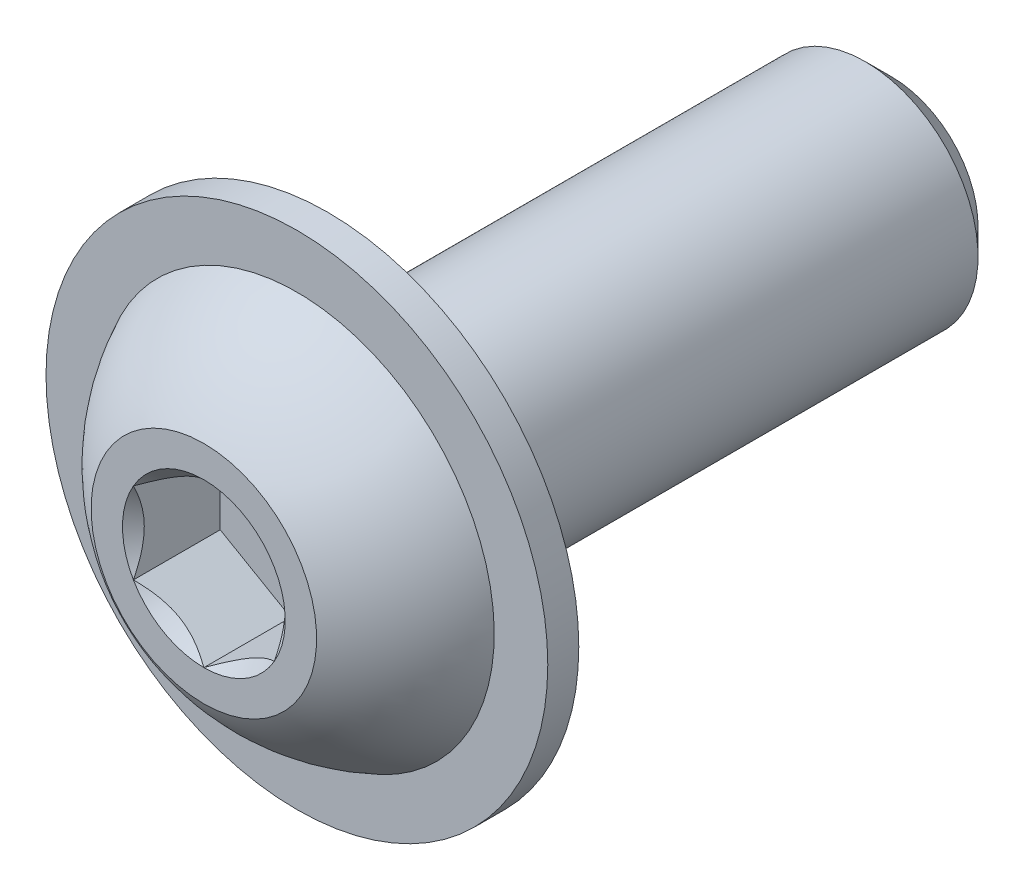
from build123d import *

# Parameters (mm, degrees)
SKETCH1_W           = 20
SKETCH1_H           = 4
CHAMFER1_SIZE       = 0.9375
SKETCH11_R          = 8.9
BOSS_EXTRUDE3_DEPTH = 1.1
CUT_EXTRUDE2_DEPTH  = 3.08


with BuildPart() as part:
    # Sketch1 → Revolve1 (revolve)
    with BuildSketch(Plane(origin=(0, 0, 0), x_dir=(0, 0, -1), z_dir=(1, 0, 0))):
        with Locations((14.4, 2)):
            Rectangle(SKETCH1_W, SKETCH1_H)
    revolve(axis=Axis((0, 0, -24.4), (0, 0, 1)))

    # Chamfer1
    chamfer1_edges = [part.edges().sort_by_distance(p)[0] for p in [
        (0, -4, -24.4),
    ]]
    chamfer(chamfer1_edges, length=CHAMFER1_SIZE)

    # Sketch7 → Revolve2 (revolve)
    with BuildSketch(Plane(origin=(0, 0, 0), x_dir=(0, 0, -1), z_dir=(1, 0, 0)), mode=Mode.PRIVATE) as revolve2_sk:
        with BuildLine():
            Line((3.3, 7), (4.4, 7))
            Line((4.4, 7), (4.4, 0))
            Line((4.4, 0), (0, 0))
            Line((0, 0), (0, 4))
            ThreePointArc((0, 4), (1.429846746, 5.74216858), (3.3, 7))
        make_face()
    revolve(revolve2_sk.sketch.rotate(Axis((0, 0, 0), (0, 0, -1)), 180), axis=Axis((0, 0, 0), (0, 0, -1)))

    # Sketch11 → Boss-Extrude3 (add)
    with BuildSketch(Plane(origin=(0, 0, -4.4), x_dir=(-1, 0, 0), z_dir=(0, 0, -1))):
        Circle(SKETCH11_R)
    extrude(amount=-BOSS_EXTRUDE3_DEPTH)

    # Sketch5 → Cut-Extrude2 (cut)
    with BuildSketch(Plane.XY):
        Polygon((2.5, -1.443375673), (2.5, 1.443375673), (0, 2.886751346), (-2.5, 1.443375673), (-2.5, -1.443375673), (0, -2.886751346), align=None)
    extrude(amount=-CUT_EXTRUDE2_DEPTH, mode=Mode.SUBTRACT)

    # Cut-Extrude3 cone 1 section (through the dimple's axis) → Cut-Extrude3 (revolve, cut)
    with BuildSketch(Plane(origin=(0, 0, 0), x_dir=(0, -1, 0), z_dir=(1, 0, 0))):
        Polygon((0, 0), (2.886751346, 0), (0, 2.886751346), align=None)
    revolve(axis=Axis((0, 0, 0), (0, 0, -1)), mode=Mode.SUBTRACT)


solid = part.part
